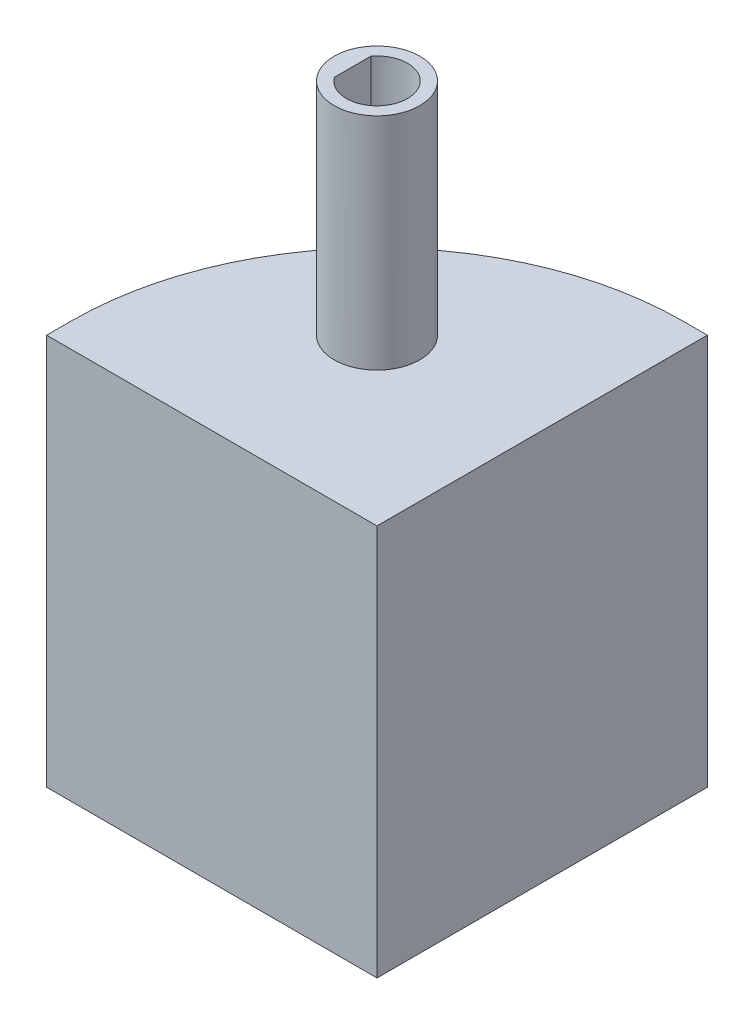
from build123d import *

# Parameters (mm, degrees)
SKETCH1_W           = 25
SKETCH1_H           = 2
EXTRUDE_THIN1_DEPTH = 25
SKETCH2_R           = 6.0005
CUT_EXTRUDE1_DEPTH  = 36.411862419
BOSS_EXTRUDE1_DEPTH = 32
BOSS_EXTRUDE2_DEPTH = 2
SKETCH7_R           = 3.5
BOSS_EXTRUDE3_DEPTH = 18


with BuildPart() as part:
    # Sketch1 → Extrude-Thin1 (new body)
    with BuildSketch(Plane.XY):
        with Locations((12.5, 1)):
            Rectangle(SKETCH1_W, SKETCH1_H)
    extrude(amount=-EXTRUDE_THIN1_DEPTH)

    # Sketch2 → Cut-Extrude1 (cut, through all)
    with BuildSketch(Plane(origin=(0, 2, 0), x_dir=(1, 0, 0), z_dir=(0, 1, 0))):
        with BuildLine():
            ThreePointArc((3.839745962, 7.5), (3.839745962, 17.5), (12.5, 22.5))
            Line((12.5, 22.5), (12.5, 25))
            Line((12.5, 25), (0, 25))
            Line((0, 25), (0, 7.5))
            Line((0, 7.5), (3.839745962, 7.5))
        make_face()
        with Locations(Location((12.5, 12.5, 0), (0, 0, 270))):
            Circle(SKETCH2_R)
    extrude(amount=-CUT_EXTRUDE1_DEPTH, mode=Mode.SUBTRACT)

    # Sketch4 → Boss-Extrude1 (add)
    with BuildSketch(Plane.XZ):
        Polygon((0, 0), (0, 2), (27, 2), (27, -25), (25, -25), (25, 0), align=None)
    extrude(amount=-BOSS_EXTRUDE1_DEPTH)

    # Sketch6 → Boss-Extrude2 (add)
    with BuildSketch(Plane(origin=(0, 32, 0), x_dir=(1, 0, 0), z_dir=(0, 1, 0))):
        with BuildLine():
            Line((0, 0), (25, 0))
            Line((25, 0), (25, 25))
            ThreePointArc((25, 25), (7.32233047, 17.67766953), (0, 0))
        make_face()
    extrude(amount=-BOSS_EXTRUDE2_DEPTH)

    # Sketch7 → Boss-Extrude3 (add)
    with BuildSketch(Plane(origin=(0, 32, 0), x_dir=(1, 0, 0), z_dir=(0, 1, 0))):
        with Locations(Location((13.5, 11.5, 0), (0, 0, 90))):
            Circle(SKETCH7_R)
        with BuildLine():
            Line((11.5, 13), (11.5, 10))
            ThreePointArc((11.5, 10), (16, 11.5), (11.5, 13))
        make_face(mode=Mode.SUBTRACT)
    extrude(amount=BOSS_EXTRUDE3_DEPTH)


solid = part.part
